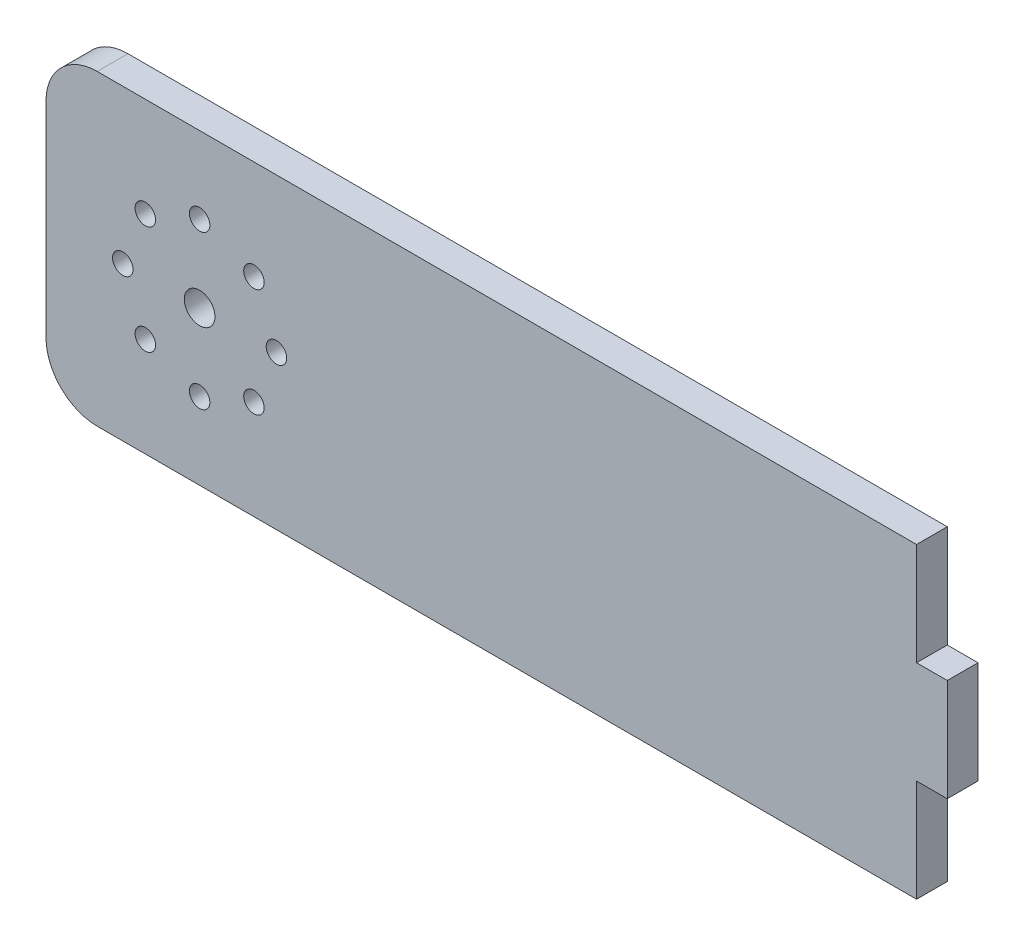
from build123d import *

# Parameters (mm, degrees)
SKETCH1_R           = 1.5
SKETCH1_R_2         = 1
BOSS_EXTRUDE1_DEPTH = 3
FILLET1_R           = 5


with BuildPart() as part:
    # Sketch1 → Boss-Extrude1 (new body)
    with BuildSketch(Plane.XY):
        Polygon((85, 30), (85, 20), (88, 20), (88, 10), (85, 10), (85, 0), (0, 0), (0, 30), align=None)
        with Locations((15, 15)):
            Circle(SKETCH1_R, mode=Mode.SUBTRACT)
        with Locations((7.5, 15)):
            Circle(SKETCH1_R_2, mode=Mode.SUBTRACT)
        with Locations((9.696699141, 20.303300859)):
            Circle(SKETCH1_R_2, mode=Mode.SUBTRACT)
        with Locations((15, 22.5)):
            Circle(SKETCH1_R_2, mode=Mode.SUBTRACT)
        with Locations((20.303300859, 20.303300859)):
            Circle(SKETCH1_R_2, mode=Mode.SUBTRACT)
        with Locations((22.5, 15)):
            Circle(SKETCH1_R_2, mode=Mode.SUBTRACT)
        with Locations((20.303300859, 9.696699141)):
            Circle(SKETCH1_R_2, mode=Mode.SUBTRACT)
        with Locations((15, 7.5)):
            Circle(SKETCH1_R_2, mode=Mode.SUBTRACT)
        with Locations((9.696699141, 9.696699141)):
            Circle(SKETCH1_R_2, mode=Mode.SUBTRACT)
    extrude(amount=BOSS_EXTRUDE1_DEPTH)

    # Fillet1
    fillet1_edges = [part.edges().sort_by_distance(p)[0] for p in [
        (0, 0, 1.5),
        (0, 30, 1.5),
    ]]
    fillet(fillet1_edges, radius=FILLET1_R)


solid = part.part
